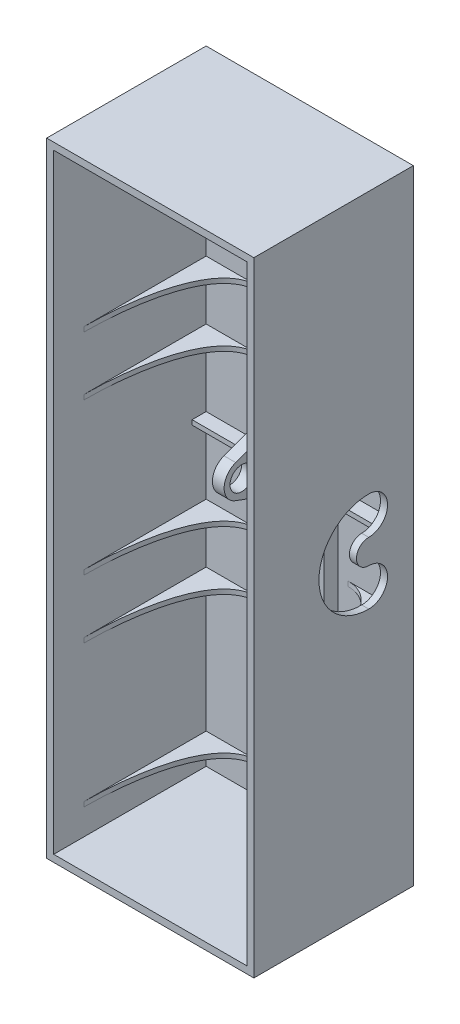
from build123d import *

# Parameters (mm, degrees)
BOSS_EXTRUDE1_DEPTH      = 68
SKETCH2_W                = 88.35
SKETCH2_H                = 263
BOSS_EXTRUDE2_DEPTH      = 3
SKETCH3_R                = 5
BOSS_EXTRUDE3_DEPTH      = 5
BOSS_EXTRUDE6_START      = 8
BOSS_EXTRUDE6_DEPTH      = 8
M6_CLEARANCE_HOLE1_D     = 6.6
M6_CLEARANCE_HOLE1_DEPTH = 8
CUT_EXTRUDE1_REACH       = 286.827
SKETCH11_W               = 88.35
SKETCH11_H               = 68
BOSS_EXTRUDE7_DEPTH      = 3
SKETCH13_W               = 21.852514987
SKETCH13_H               = 2
BOSS_EXTRUDE8_DEPTH      = 52
CUT_EXTRUDE2_REACH       = 277.542
SKETCH15_W               = 2
SKETCH15_H               = 260
SKETCH15_W_2             = 26.175
SKETCH15_H_2             = 2
SKETCH15_W_3             = 23.175
BOSS_EXTRUDE9_DEPTH      = 6
SKETCH16_W               = 15
SKETCH16_H               = 50
BOSS_EXTRUDE10_DEPTH     = 4
M6_TAPPED_HOLE2_D        = 5


with BuildPart() as part:
    # Sketch1 → Boss-Extrude1 (new body)
    with BuildSketch(Plane.XY):
        Polygon((0, 263), (0, 0), (88.35, 0), (88.35, 263.092759022), (85.35, 263.092759022), (85.35, 3), (3, 3), (3, 263), align=None)
    extrude(amount=BOSS_EXTRUDE1_DEPTH)

    # Sketch2 → Boss-Extrude2 (add)
    with BuildSketch(Plane.XY):
        with Locations((44.175, 131.5)):
            Rectangle(SKETCH2_W, SKETCH2_H)
    extrude(amount=BOSS_EXTRUDE2_DEPTH)

    # Sketch3 → Boss-Extrude3 (add)
    with BuildSketch(Plane(origin=(34.175, 0, 0), x_dir=(0, 0, -1), z_dir=(1, 0, 0))):
        with BuildLine():
            Line((-21.565151075, 140.047694656), (-3, 146.804857042))
            Line((-3, 146.804857042), (-3, 119.195142958))
            Line((-3, 119.195142958), (-21.565151075, 125.952305344))
            ThreePointArc((-21.565151075, 125.952305344), (-26.5, 133), (-21.565151075, 140.047694656))
        make_face()
        with Locations(Location((-19, 133, 0), (0, 0, 90))):
            Circle(SKETCH3_R, mode=Mode.SUBTRACT)
    extrude(amount=-BOSS_EXTRUDE3_DEPTH)

    # Sketch6 → Boss-Extrude6 (add)
    with BuildSketch(Plane(origin=(54.175, 0, 0), x_dir=(0, 0, -1), z_dir=(1, 0, 0)).offset(BOSS_EXTRUDE6_START)):
        with BuildLine():
            Line((-19, 138), (-3, 138))
            Line((-3, 138), (-3, 128))
            Line((-3, 128), (-19, 128))
            ThreePointArc((-19, 128), (-24, 133), (-19, 138))
        make_face()
    extrude(amount=-BOSS_EXTRUDE6_DEPTH)

    # M6 Clearance Hole1
    with Locations(Plane.ZY.offset(-54.175)):
        with Locations((19, 133)):
            Hole(M6_CLEARANCE_HOLE1_D / 2, depth=M6_CLEARANCE_HOLE1_DEPTH)

    # Sketch10 → Cut-Extrude1 (cut, up to next)
    with BuildSketch(Plane.ZY.offset(-85.35), mode=Mode.PRIVATE) as cut_extrude1_sk1:
        with BuildLine():
            ThreePointArc((19, 111.75), (40.25, 133), (19, 154.25))
            ThreePointArc((19, 154.25), (11, 146.25), (19, 138.25))
            ThreePointArc((19, 138.25), (24.25, 133), (19, 127.75))
            ThreePointArc((19, 127.75), (11, 119.75), (19, 111.75))
        make_face()
    cut_extrude1_tool1 = extrude(cut_extrude1_sk1.sketch, amount=-CUT_EXTRUDE1_REACH, mode=Mode.PRIVATE) & part.part
    add(cut_extrude1_tool1.solids().sort_by_distance((85.35, 133, 25.479221))[0], mode=Mode.SUBTRACT)

    # Sketch11 → Boss-Extrude7 (add)
    with BuildSketch(Plane(origin=(0, 263, 0), x_dir=(1, 0, 0), z_dir=(0, 1, 0))):
        with Locations((44.175, -34)):
            Rectangle(SKETCH11_W, SKETCH11_H)
    extrude(amount=BOSS_EXTRUDE7_DEPTH)

    # Sketch13 → Boss-Extrude8 (add)
    with BuildSketch(Plane.XY.offset(3)):
        with Locations((13.926257494, 250.979741765)):
            Rectangle(SKETCH13_W, SKETCH13_H)
        with Locations((13.926257494, 190.418933856)):
            Rectangle(SKETCH13_W, SKETCH13_H)
        with Locations((13.926257494, 165.349802202)):
            Rectangle(SKETCH13_W, SKETCH13_H)
        with Locations((13.926257494, 15.020258235)):
            Rectangle(SKETCH13_W, SKETCH13_H)
        with Locations((13.926257494, 75.581066144)):
            Rectangle(SKETCH13_W, SKETCH13_H)
        with Locations((13.926257494, 100.650197798)):
            Rectangle(SKETCH13_W, SKETCH13_H)
    boss_extrude8 = extrude(amount=BOSS_EXTRUDE8_DEPTH)

    # Cut-Extrude2: up to this face of the body (flat: up to its plane)
    cut_extrude2_end = Plane(part.part.faces().sort_by_distance((13.926257494, 251.979741765, 29))[0])
    # Sketch14 → Cut-Extrude2 (cut, up to the picked face)
    with BuildSketch(Plane.XZ.offset(-14.020258235), mode=Mode.PRIVATE) as cut_extrude2_sk1:
        with BuildLine():
            Line((24.852514987, 3), (24.852514987, 55))
            Line((24.852514987, 55), (3, 55))
            add(Edge.make_bspline(
                [(3, 55), (3, 38.07209504), (6.271591764, 3), (24.852514987, 3)],
                knots=[0, 0, 0, 0, 1, 1, 1, 1], degree=3))
        make_face()
    cut_extrude2_tool1 = split(extrude(cut_extrude2_sk1.sketch, amount=-CUT_EXTRUDE2_REACH, mode=Mode.PRIVATE), bisect_by=cut_extrude2_end, keep=Keep.BOTH, mode=Mode.PRIVATE)
    cut_extrude2 = cut_extrude2_tool1.solids().sort_by(Axis((15.415824, 14.020258, 32.441984), (0, 1, 0)))[0]
    add(cut_extrude2, mode=Mode.SUBTRACT)

    # Mirror3: Boss-Extrude8, Cut-Extrude2 across plane
    add(boss_extrude8.mirror(Plane(origin=(44.175, 0, 0), x_dir=(0, 0, 1), z_dir=(1, 0, 0))))
    add(cut_extrude2.mirror(Plane(origin=(44.175, 0, 0), x_dir=(0, 0, 1), z_dir=(1, 0, 0))), mode=Mode.SUBTRACT)

    # Sketch15 → Boss-Extrude9 (add)
    with BuildSketch(Plane.XY.offset(3)):
        with Locations((31.675, 133)):
            Rectangle(SKETCH15_W, SKETCH15_H)
        with Locations((58.175, 133)):
            Rectangle(SKETCH15_W, SKETCH15_H)
        with Locations((16.0875, 133)):
            Rectangle(SKETCH15_W_2, SKETCH15_H_2)
        with Locations((73.7625, 133)):
            Rectangle(SKETCH15_W_3, SKETCH15_H_2)
    extrude(amount=BOSS_EXTRUDE9_DEPTH)

    # Sketch16 → Boss-Extrude10 (add)
    with BuildSketch(Plane.XY.offset(3)):
        with Locations((44.175, 233)):
            Rectangle(SKETCH16_W, SKETCH16_H)
        with Locations((44.175, 33)):
            Rectangle(SKETCH16_W, SKETCH16_H)
    extrude(amount=BOSS_EXTRUDE10_DEPTH)

    # M6 Tapped Hole2 (through all)
    with Locations(Plane.XY.offset(7)):
        with Locations((44.175, 250.24), (44.175, 215.76), (44.175, 50.24), (44.175, 15.76)):
            Hole(M6_TAPPED_HOLE2_D / 2)


solid = part.part
